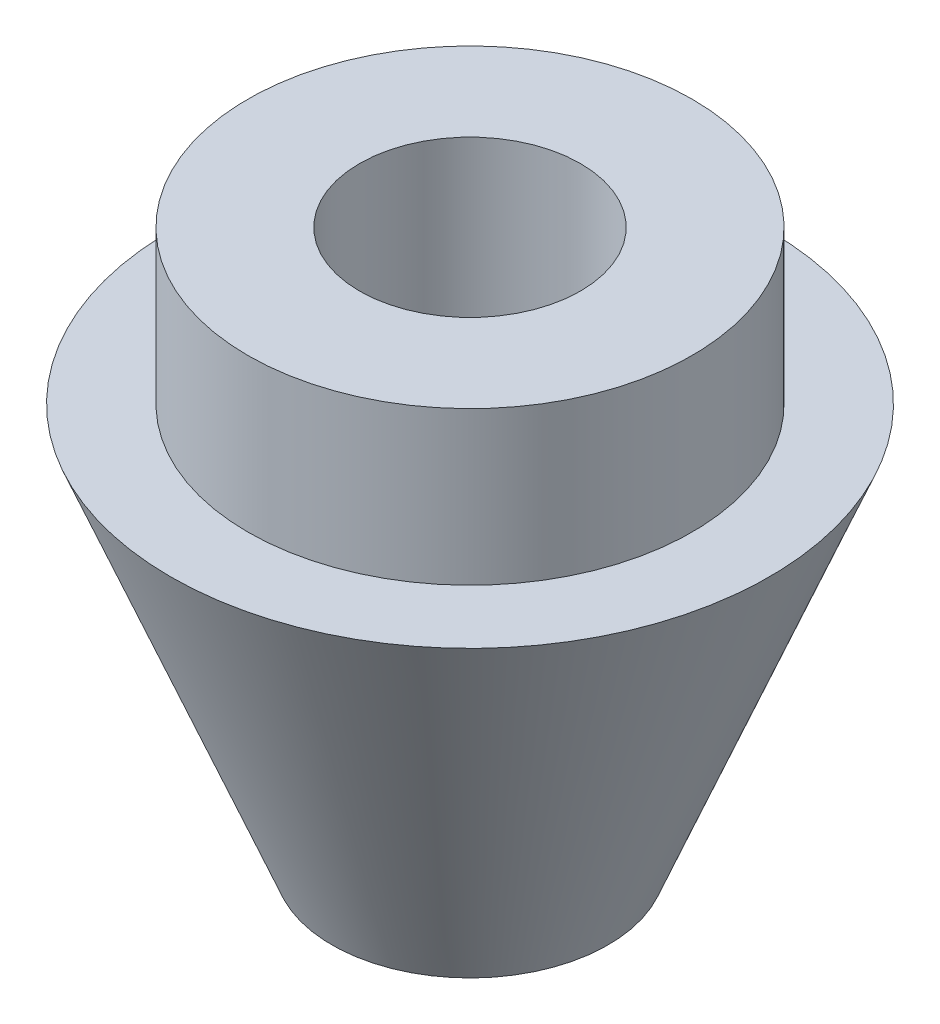
from build123d import *

# Parameters (mm, degrees)
SKETCH_362_R       = 2.54
CUT_EXTRUDE4_DEPTH = 12.7


with BuildPart() as part:
    # Sketch1 → Revolve1 (revolve)
    with BuildSketch(Plane.XY, mode=Mode.PRIVATE) as revolve1_sk:
        Polygon((0, 0), (0, 12.7), (-5.1054, 12.7), (-5.1054, 9.183788707), (-6.8834, 9.183788707), (-3.175, 0), align=None)
    revolve(revolve1_sk.sketch.rotate(Axis((0, 0, 0), (0, 1, 0)), 270), axis=Axis((0, 0, 0), (0, 1, 0)))

    # Sketch 362 → Cut-Extrude4 (cut)
    with BuildSketch(Plane(origin=(0, 12.7, 0), x_dir=(1, 0, 0), z_dir=(0, 1, 0))):
        with Locations(Location((0, 0, 0), (0, 0, 270))):
            Circle(SKETCH_362_R)
    extrude(amount=-CUT_EXTRUDE4_DEPTH, mode=Mode.SUBTRACT)


solid = part.part
